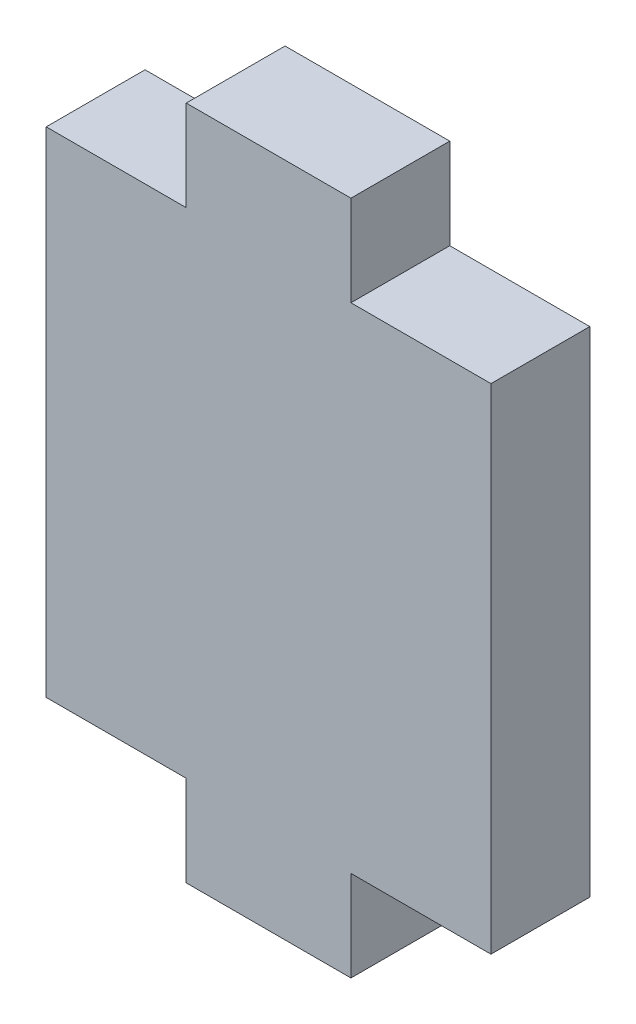
from build123d import *

# Parameters (mm, degrees)
BOSS_EXTRUDE1_DEPTH = 6


with BuildPart() as part:
    # Sketch1 → Boss-Extrude1 (new body)
    with BuildSketch(Plane.XY):
        Polygon((5, -15), (13.5, -15), (13.5, 15), (5, 15), (5, 20.5), (-5, 20.5), (-5, 15), (-13.5, 15), (-13.5, -15), (-5, -15), (-5, -20.5), (5, -20.5), align=None)
    extrude(amount=BOSS_EXTRUDE1_DEPTH)


solid = part.part
